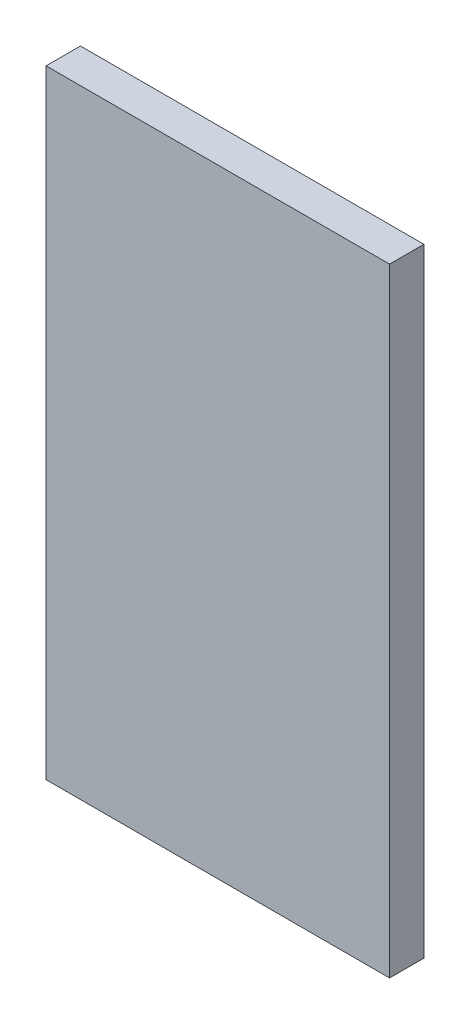
from build123d import *

# Parameters (mm, degrees)
ESQUISSE1_W        = 100
ESQUISSE1_H        = 180
BOSS_EXTRU_1_DEPTH = 10


with BuildPart() as part:
    # Esquisse1 → Boss.-Extru.1 (new body)
    with BuildSketch(Plane.XY):
        with Locations((50, 90)):
            Rectangle(ESQUISSE1_W, ESQUISSE1_H)
    extrude(amount=BOSS_EXTRU_1_DEPTH)


solid = part.part
